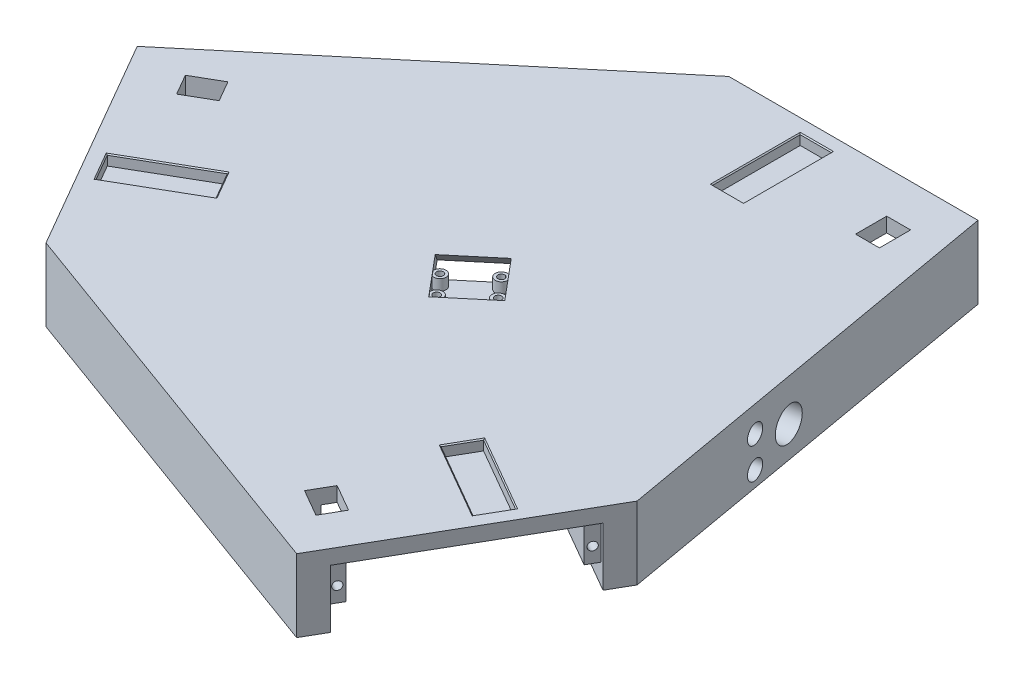
from build123d import *

# Parameters (mm, degrees)
BOSS_EXTRUDE1_DEPTH                     = 35
SKETCH2_W                               = 96
SKETCH2_H                               = 28
CUT_EXTRUDE1_DEPTH                      = 2.5
SKETCH3_W                               = 42
SKETCH3_H                               = 18
CUT_EXTRUDE2_DEPTH                      = 56
SKETCH4_R                               = 2
CUT_EXTRUDE3_DEPTH                      = 6
MOTORDRIVERCUTOUTTHROUGHSHELL_START     = -13
MOTORDRIVERCUTOUTTHROUGHSHELL_DEPTH     = 19
SKETCH20_W                              = 11.5
SKETCH20_H                              = 15
CUT_EXTRUDE8_DEPTH                      = 239.86886221
SKETCH27_W                              = 5.72
SKETCH27_H                              = 7.5
SKETCH27_W_2                            = 11.72
SKETCH27_H_2                            = 6.5
SKETCH27_W_3                            = 5.78
SKETCH27_H_3                            = 4
CUT_EXTRUDE13_DEPTH                     = 31
CUT_EXTRUDE13_DIRECTION_2_REACH         = 323.867
SKETCH29_W                              = 42.3
SKETCH29_H                              = 5.25
CUT_EXTRUDE14_DEPTH                     = 15
CHAMFER1_SIZE                           = 0.5
MOTOR_DRIVER_PATTERNED_COUNT            = 3
CHAMFER1_OF_MOTOR_DRIVER_PATTERNED_SIZE = 0.5
SHELLKINDA_DEPTH                        = 27.5
CUT_EXTRUDE18_REACH                     = 350.786
SKETCH36_R                              = 8
SKETCH36_R_2                            = 4.5
SKETCH37_R                              = 11
SKETCH37_R_2                            = 8
BOSS_EXTRUDE5_DEPTH                     = 11
SKETCH11_R                              = 3.15
SKETCH11_R_2                            = 1.65
RASPBERRYPI5_STANDOFF_DEPTH             = 5
RASPPI_START                            = -6.5
SKETCH34_R                              = 1.65
RASPPI_STANDOFF_DEPTH_DEPTH             = 6.5
RASPPICUTOUT_REACH                      = 335.716
SKETCH17_W                              = 60
SKETCH17_H                              = 20
CAMERA_CUTOUT_DEPTH                     = 6
CAMERACABLECUTOUT_REACH                 = 242.179
SKETCH32_W                              = 26
SKETCH32_H                              = 8.485281374
CAMERA_STANDOFFS_REACH                  = 240.759
SKETCH13_R                              = 2.95
SKETCH13_R_2                            = 1.65
CAMERASTANDOFFS_REACH                   = 240.759
SKETCH35_R                              = 1.65
SKETCH38_R                              = 2.05
CABLE_ROUTING_HOLES_DEPTH               = 3


with BuildPart() as part:
    # Sketch1 → Boss-Extrude1 (new body)
    with BuildSketch(Plane(origin=(0, 0, 0), x_dir=(1, 0, 0), z_dir=(0, 1, 0))):
        Polygon((-20, 144.337567297), (100, 144.337567297), (135, -54.848275573), (75, -158.771324027), (-115, -89.489291724), (-175, 14.43375673), align=None)
    extrude(amount=BOSS_EXTRUDE1_DEPTH)

    # Sketch2 → Cut-Extrude1 (cut)
    with BuildSketch(Plane(origin=(0, 0, -144.337567297), x_dir=(-1, 0, 0), z_dir=(0, 0, -1))):
        with Locations((-40, 14)):
            Rectangle(SKETCH2_W, SKETCH2_H)
    cut_extrude1 = extrude(amount=-CUT_EXTRUDE1_DEPTH, mode=Mode.SUBTRACT)

    # Sketch3 → Cut-Extrude2 (cut)
    with BuildSketch(Plane(origin=(0, 0, -141.837567297), x_dir=(-1, 0, 0), z_dir=(0, 0, -1))):
        with Locations((-61, 19)):
            Rectangle(SKETCH3_W, SKETCH3_H)
        with Locations((-19, 19)):
            Rectangle(SKETCH3_W, SKETCH3_H)
        Polygon((-88, 10), (-88, 0), (8, 0), (8, 10), (2, 10), (-40, 10), (-82, 10), align=None)
    cut_extrude2 = extrude(amount=-CUT_EXTRUDE2_DEPTH, mode=Mode.SUBTRACT)

    # Sketch4 → Cut-Extrude3 (cut)
    with BuildSketch(Plane(origin=(0, 0, -141.837567297), x_dir=(-1, 0, 0), z_dir=(0, 0, -1))):
        with Locations((-85, 17.25)):
            Circle(SKETCH4_R)
        with Locations((5, 17.25)):
            Circle(SKETCH4_R)
    cut_extrude3 = extrude(amount=-CUT_EXTRUDE3_DEPTH, mode=Mode.SUBTRACT)

    # Sketch5 → MotorDriverCutoutThroughShell (cut)
    with BuildSketch(Plane(origin=(0, 0, -85.837567297), x_dir=(-1, 0, 0), z_dir=(0, 0, -1)).offset(MOTORDRIVERCUTOUTTHROUGHSHELL_START)):
        Polygon((-72.5, 14.75), (-72.5, 30), (-7.5, 30), (-7.5, 14.75), (-7.5, 0), (-72.5, 0), align=None)
    motordrivercutoutthroughshell = extrude(amount=MOTORDRIVERCUTOUTTHROUGHSHELL_DEPTH, mode=Mode.SUBTRACT)

    # Sketch20 → Cut-Extrude8 (cut, through all)
    with BuildSketch(Plane(origin=(0, 35, 0), x_dir=(1, 0, 0), z_dir=(0, 1, 0))):
        with Locations((82.03, 116.587567297)):
            Rectangle(SKETCH20_W, SKETCH20_H)
    cut_extrude8 = extrude(amount=-CUT_EXTRUDE8_DEPTH, mode=Mode.SUBTRACT)

    # Sketch27 → Cut-Extrude13 (cut)
    with BuildSketch(Plane(origin=(0, 0, -109.087567297), x_dir=(-1, 0, 0), z_dir=(0, 0, -1))):
        Polygon((-76.28, 6.5), (-76.28, 14), (-82, 14), (-82, 10), (-87.78, 10), (-87.78, 14), (-88, 14), (-88, 6.5), align=None)
        with Locations((-79.14, 17.75)):
            Rectangle(SKETCH27_W, SKETCH27_H)
        with Locations((-82.14, 3.25)):
            Rectangle(SKETCH27_W_2, SKETCH27_H_2)
        with Locations((-84.89, 17.75)):
            Rectangle(SKETCH27_W_3, SKETCH27_H)
        with Locations((-84.89, 12)):
            Rectangle(SKETCH27_W_3, SKETCH27_H_3)
    cut_extrude13 = extrude(amount=-CUT_EXTRUDE13_DEPTH, mode=Mode.SUBTRACT)

    # Cut-Extrude13 direction 2: up to this face of the body (flat: up to its plane)
    cut_extrude13_direction_2_end = Plane(part.part.faces().sort_by_distance((83.642411401, 24.452747372, -124.087567297))[0])
    # Sketch27 → Cut-Extrude13 direction 2 (cut, up to the picked face)
    with BuildSketch(Plane(origin=(0, 0, -109.087567297), x_dir=(-1, 0, 0), z_dir=(0, 0, -1)), mode=Mode.PRIVATE) as cut_extrude13_direction_2_sk1:
        Polygon((-76.28, 6.5), (-76.28, 14), (-82, 14), (-82, 10), (-87.78, 10), (-87.78, 14), (-88, 14), (-88, 6.5), align=None)
    cut_extrude13_direction_2_tool1 = split(extrude(cut_extrude13_direction_2_sk1.sketch, amount=CUT_EXTRUDE13_DIRECTION_2_REACH, mode=Mode.PRIVATE), bisect_by=cut_extrude13_direction_2_end, keep=Keep.BOTH, mode=Mode.PRIVATE)
    # Sketch27 → Cut-Extrude13 direction 2 (cut, up to the picked face)
    with BuildSketch(Plane(origin=(0, 0, -109.087567297), x_dir=(-1, 0, 0), z_dir=(0, 0, -1)), mode=Mode.PRIVATE) as cut_extrude13_direction_2_sk2:
        with Locations((-79.14, 17.75)):
            Rectangle(SKETCH27_W, SKETCH27_H)
    cut_extrude13_direction_2_tool2 = split(extrude(cut_extrude13_direction_2_sk2.sketch, amount=CUT_EXTRUDE13_DIRECTION_2_REACH, mode=Mode.PRIVATE), bisect_by=cut_extrude13_direction_2_end, keep=Keep.BOTH, mode=Mode.PRIVATE)
    # Sketch27 → Cut-Extrude13 direction 2 (cut, up to the picked face)
    with BuildSketch(Plane(origin=(0, 0, -109.087567297), x_dir=(-1, 0, 0), z_dir=(0, 0, -1)), mode=Mode.PRIVATE) as cut_extrude13_direction_2_sk3:
        with Locations((-82.14, 3.25)):
            Rectangle(SKETCH27_W_2, SKETCH27_H_2)
    cut_extrude13_direction_2_tool3 = split(extrude(cut_extrude13_direction_2_sk3.sketch, amount=CUT_EXTRUDE13_DIRECTION_2_REACH, mode=Mode.PRIVATE), bisect_by=cut_extrude13_direction_2_end, keep=Keep.BOTH, mode=Mode.PRIVATE)
    # Sketch27 → Cut-Extrude13 direction 2 (cut, up to the picked face)
    with BuildSketch(Plane(origin=(0, 0, -109.087567297), x_dir=(-1, 0, 0), z_dir=(0, 0, -1)), mode=Mode.PRIVATE) as cut_extrude13_direction_2_sk4:
        with Locations((-84.89, 17.75)):
            Rectangle(SKETCH27_W_3, SKETCH27_H)
    cut_extrude13_direction_2_tool4 = split(extrude(cut_extrude13_direction_2_sk4.sketch, amount=CUT_EXTRUDE13_DIRECTION_2_REACH, mode=Mode.PRIVATE), bisect_by=cut_extrude13_direction_2_end, keep=Keep.BOTH, mode=Mode.PRIVATE)
    # Sketch27 → Cut-Extrude13 direction 2 (cut, up to the picked face)
    with BuildSketch(Plane(origin=(0, 0, -109.087567297), x_dir=(-1, 0, 0), z_dir=(0, 0, -1)), mode=Mode.PRIVATE) as cut_extrude13_direction_2_sk5:
        with Locations((-84.89, 12)):
            Rectangle(SKETCH27_W_3, SKETCH27_H_3)
    cut_extrude13_direction_2_tool5 = split(extrude(cut_extrude13_direction_2_sk5.sketch, amount=CUT_EXTRUDE13_DIRECTION_2_REACH, mode=Mode.PRIVATE), bisect_by=cut_extrude13_direction_2_end, keep=Keep.BOTH, mode=Mode.PRIVATE)
    cut_extrude13_direction_2_1 = cut_extrude13_direction_2_tool1.solids().sort_by(Axis((81.158524, 9.625425, -109.087567), (0, 0, -1)))[0]
    add(cut_extrude13_direction_2_1, mode=Mode.SUBTRACT)
    cut_extrude13_direction_2_2 = cut_extrude13_direction_2_tool2.solids().sort_by(Axis((79.14, 17.75, -109.087567), (0, 0, -1)))[0]
    add(cut_extrude13_direction_2_2, mode=Mode.SUBTRACT)
    cut_extrude13_direction_2_3 = cut_extrude13_direction_2_tool3.solids().sort_by(Axis((82.14, 3.25, -109.087567), (0, 0, -1)))[0]
    add(cut_extrude13_direction_2_3, mode=Mode.SUBTRACT)
    cut_extrude13_direction_2_4 = cut_extrude13_direction_2_tool4.solids().sort_by(Axis((84.89, 17.75, -109.087567), (0, 0, -1)))[0]
    add(cut_extrude13_direction_2_4, mode=Mode.SUBTRACT)
    cut_extrude13_direction_2_5 = cut_extrude13_direction_2_tool5.solids().sort_by(Axis((84.89, 12, -109.087567), (0, 0, -1)))[0]
    add(cut_extrude13_direction_2_5, mode=Mode.SUBTRACT)
    cut_extrude13_direction_2 = cut_extrude13_direction_2_1 + cut_extrude13_direction_2_2 + cut_extrude13_direction_2_3 + cut_extrude13_direction_2_4 + cut_extrude13_direction_2_5  # Cut-Extrude13 direction 2 as one shape, for the pattern or mirror that repeats it

    # Sketch29 → Cut-Extrude14 (cut)
    with BuildSketch(Plane(origin=(36, 0, 0), x_dir=(0, 0, -1), z_dir=(1, 0, 0))):
        with Locations((116.587567297, 32.625)):
            Rectangle(SKETCH29_W, SKETCH29_H)
    cut_extrude14 = extrude(amount=-CUT_EXTRUDE14_DEPTH, mode=Mode.SUBTRACT)

    # Chamfer1
    chamfer1_edges = [part.edges().sort_by_distance(p)[0] for p in [
        (36, 35, -116.587567297),
        (28.5, 35, -137.737567297),
        (28.5, 35, -95.437567297),
        (21, 35, -116.587567297),
    ]]
    chamfer(chamfer1_edges, length=CHAMFER1_SIZE)

    # Motor/Driver Patterned: Cut-Extrude1, Cut-Extrude2, Cut-Extrude3, MotorDriverCutoutThroughShell, Cut-Extrude8, Cut-Extrude13, Cut-Extrude13 direction 2, Cut-Extrude14 ×3 about axis
    motor_driver_patterned_axis = Axis((0, 0, 0), (0, 1, 0))
    add([cut_extrude1.rotate(motor_driver_patterned_axis, i * 360 / MOTOR_DRIVER_PATTERNED_COUNT) for i in range(1, MOTOR_DRIVER_PATTERNED_COUNT)], mode=Mode.SUBTRACT)
    add([cut_extrude2.rotate(motor_driver_patterned_axis, i * 360 / MOTOR_DRIVER_PATTERNED_COUNT) for i in range(1, MOTOR_DRIVER_PATTERNED_COUNT)], mode=Mode.SUBTRACT)
    add([cut_extrude3.rotate(motor_driver_patterned_axis, i * 360 / MOTOR_DRIVER_PATTERNED_COUNT) for i in range(1, MOTOR_DRIVER_PATTERNED_COUNT)], mode=Mode.SUBTRACT)
    add([motordrivercutoutthroughshell.rotate(motor_driver_patterned_axis, i * 360 / MOTOR_DRIVER_PATTERNED_COUNT) for i in range(1, MOTOR_DRIVER_PATTERNED_COUNT)], mode=Mode.SUBTRACT)
    add([cut_extrude8.rotate(motor_driver_patterned_axis, i * 360 / MOTOR_DRIVER_PATTERNED_COUNT) for i in range(1, MOTOR_DRIVER_PATTERNED_COUNT)], mode=Mode.SUBTRACT)
    add([cut_extrude13.rotate(motor_driver_patterned_axis, i * 360 / MOTOR_DRIVER_PATTERNED_COUNT) for i in range(1, MOTOR_DRIVER_PATTERNED_COUNT)], mode=Mode.SUBTRACT)
    add([cut_extrude13_direction_2.rotate(motor_driver_patterned_axis, i * 360 / MOTOR_DRIVER_PATTERNED_COUNT) for i in range(1, MOTOR_DRIVER_PATTERNED_COUNT)], mode=Mode.SUBTRACT)
    add([cut_extrude14.rotate(motor_driver_patterned_axis, i * 360 / MOTOR_DRIVER_PATTERNED_COUNT) for i in range(1, MOTOR_DRIVER_PATTERNED_COUNT)], mode=Mode.SUBTRACT)

    # Chamfer1 of Motor/Driver Patterned
    chamfer1_of_motor_driver_patterned_edges = [part.edges().sort_by_distance(p)[0] for p in [
        (-118.967795045, 35, 27.116869112),
        (-133.534232335, 35, 44.187059641),
        (-96.901357755, 35, 23.037059641),
        (-111.467795045, 35, 40.107250169),
        (82.967795045, 35, 89.470698185),
        (105.034232335, 35, 93.550507657),
        (68.401357755, 35, 72.400507657),
        (90.467795045, 35, 76.480317128),
    ]]
    chamfer(chamfer1_of_motor_driver_patterned_edges, length=CHAMFER1_OF_MOTOR_DRIVER_PATTERNED_SIZE)

    # Sketch22 → ShellKinda (cut)
    with BuildSketch(Plane.XZ):
        Polygon((-60.09232335, 52.592177407), (-71.59232335, 32.67359312), (-66.829183629, 29.92359312), (-99.329183629, -26.368058126), (-110.587513879, -19.868058126), (-112.477513879, -23.141634152), (-105.765816999, -27.016634152), (-111.625816999, -37.166451884), (-111.84232335, -37.041451884), (-119.833476078, -50.88253442), (-17.27274258, -136.837567297), (-15.5, -136.837567297), (-15.5, -78.337567297), (7.5, -78.337567297), (7.5, -72.837567297), (72.5, -72.837567297), (72.5, -85.837567297), (76.28, -85.837567297), (76.28, -78.087567297), (88, -78.087567297), (88, -78.337567297), (103.982305456, -78.337567297), (127.141180762, 53.460149781), (126.254809472, 54.99538989), (75.59232335, 25.74538989), (64.09232335, 45.663974177), (59.329183629, 42.913974177), (26.829183629, 99.205625423), (38.087513879, 105.705625423), (36.197513879, 108.979201449), (29.485816999, 105.104201449), (23.625816999, 115.254019182), (23.84232335, 115.379019182), (15.851170622, 129.220101718), (-109.868438181, 83.377417516), (-110.754809472, 81.842177407), align=None)
    extrude(amount=-SHELLKINDA_DEPTH, mode=Mode.SUBTRACT)

    # Sketch36 → Cut-Extrude18 (cut, up to next)
    with BuildSketch(Plane(origin=(121.607579462, 0, -21.368312225), x_dir=(0.17306386175195196, 0, 0.9849106049563591), z_dir=(-0.9849106049563591, 0, 0.17306386175195196)), mode=Mode.PRIVATE) as cut_extrude18_sk1:
        with Locations(Location((-12.615730388, 15, 0), (0, 0, 180))):
            Circle(SKETCH36_R)
    cut_extrude18_tool1 = extrude(cut_extrude18_sk1.sketch, amount=CUT_EXTRUDE18_REACH, mode=Mode.PRIVATE) & part.part
    # Sketch36 → Cut-Extrude18 (cut, up to next)
    with BuildSketch(Plane(origin=(121.607579462, 0, -21.368312225), x_dir=(0.17306386175195196, 0, 0.9849106049563591), z_dir=(-0.9849106049563591, 0, 0.17306386175195196)), mode=Mode.PRIVATE) as cut_extrude18_sk2:
        with Locations(Location((7.384269612, 22.5, 0), (0, 0, 180))):
            Circle(SKETCH36_R_2)
    cut_extrude18_tool2 = extrude(cut_extrude18_sk2.sketch, amount=CUT_EXTRUDE18_REACH, mode=Mode.PRIVATE) & part.part
    # Sketch36 → Cut-Extrude18 (cut, up to next)
    with BuildSketch(Plane(origin=(121.607579462, 0, -21.368312225), x_dir=(0.17306386175195196, 0, 0.9849106049563591), z_dir=(-0.9849106049563591, 0, 0.17306386175195196)), mode=Mode.PRIVATE) as cut_extrude18_sk3:
        with Locations(Location((7.384269612, 7.5, 0), (0, 0, 180))):
            Circle(SKETCH36_R_2)
    cut_extrude18_tool3 = extrude(cut_extrude18_sk3.sketch, amount=CUT_EXTRUDE18_REACH, mode=Mode.PRIVATE) & part.part
    add(cut_extrude18_tool1.solids().sort_by_distance((119.424252, 15, -33.793679))[0], mode=Mode.SUBTRACT)
    add(cut_extrude18_tool2.solids().sort_by_distance((122.88553, 22.5, -14.095467))[0], mode=Mode.SUBTRACT)
    add(cut_extrude18_tool3.solids().sort_by_distance((122.88553, 7.5, -14.095467))[0], mode=Mode.SUBTRACT)

    # Sketch37 → Boss-Extrude5 (add)
    with BuildSketch(Plane(origin=(66.088285485, 0, -337.329951263), x_dir=(0.17306386175195196, 0, 0.9849106049563591), z_dir=(-0.9849106049563591, 0, 0.17306386175195196))):
        with Locations(Location((308.186622077, 15, 0), (0, 0, 180))):
            Circle(SKETCH37_R)
        with Locations(Location((308.186622077, 15, 0), (0, 0, 180))):
            Circle(SKETCH37_R_2, mode=Mode.SUBTRACT)
    extrude(amount=BOSS_EXTRUDE5_DEPTH)

    # Sketch11 → RaspberryPi5 Standoff (add)
    # profile 1 of 4: a face of its own
    with BuildSketch(Plane(origin=(0, 30, 0), x_dir=(1, 0, 0), z_dir=(0, 1, 0))):
        with Locations(Location((-0.794892653, 39.090667941, 0), (0, 0, 270))):
            Circle(SKETCH11_R)
        with Locations(Location((-0.794892653, 39.090667941, 0), (0, 0, 270))):
            Circle(SKETCH11_R_2, mode=Mode.SUBTRACT)
    # profile 2 of 4: a face of its own
    with BuildSketch(Plane(origin=(0, 30, 0), x_dir=(1, 0, 0), z_dir=(0, 1, 0))):
        with Locations(Location((-38.05020684, 83.543357002, 0), (0, 0, 270))):
            Circle(SKETCH11_R)
        with Locations(Location((-38.05020684, 83.543357002, 0), (0, 0, 270))):
            Circle(SKETCH11_R_2, mode=Mode.SUBTRACT)
    # profile 3 of 4: a face of its own
    with BuildSketch(Plane(origin=(0, 30, 0), x_dir=(1, 0, 0), z_dir=(0, 1, 0))):
        with Locations(Location((-75.60506484, 52.069039844, 0), (0, 0, 270))):
            Circle(SKETCH11_R)
        with Locations(Location((-75.60506484, 52.069039844, 0), (0, 0, 270))):
            Circle(SKETCH11_R_2, mode=Mode.SUBTRACT)
    # profile 4 of 4: a face of its own
    with BuildSketch(Plane(origin=(0, 30, 0), x_dir=(1, 0, 0), z_dir=(0, 1, 0))):
        with Locations(Location((-38.349750653, 7.616350782, 0), (0, 0, 270))):
            Circle(SKETCH11_R)
        with Locations(Location((-38.349750653, 7.616350782, 0), (0, 0, 270))):
            Circle(SKETCH11_R_2, mode=Mode.SUBTRACT)
    extrude(amount=-RASPBERRYPI5_STANDOFF_DEPTH)

    # Sketch34 → RaspPi Standoff Depth (cut)
    with BuildSketch(Plane.XZ.offset(-27.5).offset(RASPPI_START)):
        with Locations(Location((-38.05020684, -83.543357002, 0), (0, 0, 90))):
            Circle(SKETCH34_R)
        with Locations(Location((-75.60506484, -52.069039844, 0), (0, 0, 90))):
            Circle(SKETCH34_R)
        with Locations(Location((-0.794892653, -39.090667941, 0), (0, 0, 90))):
            Circle(SKETCH34_R)
        with Locations(Location((-38.349750653, -7.616350782, 0), (0, 0, 90))):
            Circle(SKETCH34_R)
    extrude(amount=RASPPI_STANDOFF_DEPTH_DEPTH, mode=Mode.SUBTRACT)

    # Sketch17 → RaspPiCutout (cut, up to next)
    with BuildSketch(Plane(origin=(-79.309290954, 0, -94.631096995), x_dir=(-0.7664256734729306, 0, 0.6423330032324082), z_dir=(-0.6423330032324082, 0, -0.7664256734729307)), mode=Mode.PRIVATE) as rasppicutout_sk1:
        with Locations((0, 15)):
            Rectangle(SKETCH17_W, SKETCH17_H)
    rasppicutout_tool1 = extrude(rasppicutout_sk1.sketch, amount=-RASPPICUTOUT_REACH, mode=Mode.PRIVATE) & part.part
    add(rasppicutout_tool1.solids().sort_by_distance((-79.309291, 15, -94.631097))[0], mode=Mode.SUBTRACT)

    # Sketch31 → Camera Cutout (cut)
    with BuildSketch(Plane(origin=(0, 35, 0), x_dir=(1, 0, 0), z_dir=(0, 1, 0))):
        Polygon((-16.418980438, -0.647751024), (3.508087073, 16.05290706), (19.566412153, -3.107734776), (-0.360655357, -19.80839286), align=None)
    extrude(amount=-CAMERA_CUTOUT_DEPTH, mode=Mode.SUBTRACT)

    # CameraCableCutout: up to this plane
    cameracablecutout_end = Plane(origin=(0, 27.5, 0), z_dir=(0, 1, 0))
    # Sketch32 → CameraCableCutout (cut, up to the surface)
    with BuildSketch(Plane(origin=(8.013104215, 12.475, 9.561160277), x_dir=(-0.7664256734729306, 0, 0.6423330032324083), z_dir=(0.4541980223655573, 0.7071067811865464, 0.5419447909881768)), mode=Mode.PRIVATE) as cameracablecutout_sk1:
        with Locations((0, -27.612519805)):
            Rectangle(SKETCH32_W, SKETCH32_H)
    cameracablecutout_tool1 = split(extrude(cameracablecutout_sk1.sketch, amount=-CAMERACABLECUTOUT_REACH, mode=Mode.PRIVATE), bisect_by=cameracablecutout_end, keep=Keep.BOTH, mode=Mode.PRIVATE)
    add(cameracablecutout_tool1.solids().sort_by_distance((-4.528448, 32, -5.403301))[0], mode=Mode.SUBTRACT)

    # Sketch13 → Camera StandOffs (add, up to next)
    with BuildSketch(Plane(origin=(0, 34.24, 0), x_dir=(1, 0, 0), z_dir=(0, 1, 0)), mode=Mode.PRIVATE) as camera_standoffs_sk1:
        with Locations((-8.047469571, -6.744496534)):
            Circle(SKETCH13_R)
        with Locations(Location((-8.047469571, -6.744496534, 0), (0, 0, 270))):
            Circle(SKETCH13_R_2, mode=Mode.SUBTRACT)
    camera_standoffs_tool1 = extrude(camera_standoffs_sk1.sketch, amount=-CAMERA_STANDOFFS_REACH, mode=Mode.PRIVATE) - part.part
    # Sketch13 → Camera StandOffs (add, up to next)
    with BuildSketch(Plane(origin=(0, 34.24, 0), x_dir=(1, 0, 0), z_dir=(0, 1, 0)), mode=Mode.PRIVATE) as camera_standoffs_sk2:
        with Locations((8.047469571, 6.744496534)):
            Circle(SKETCH13_R)
        with Locations(Location((8.047469571, 6.744496534, 0), (0, 0, 270))):
            Circle(SKETCH13_R_2, mode=Mode.SUBTRACT)
    camera_standoffs_tool2 = extrude(camera_standoffs_sk2.sketch, amount=-CAMERA_STANDOFFS_REACH, mode=Mode.PRIVATE) - part.part
    # Sketch13 → Camera StandOffs (add, up to next)
    with BuildSketch(Plane(origin=(0, 34.24, 0), x_dir=(1, 0, 0), z_dir=(0, 1, 0)), mode=Mode.PRIVATE) as camera_standoffs_sk3:
        with Locations((16.076632112, -2.835824384)):
            Circle(SKETCH13_R)
        with Locations(Location((16.076632112, -2.835824384, 0), (0, 0, 270))):
            Circle(SKETCH13_R_2, mode=Mode.SUBTRACT)
    camera_standoffs_tool3 = extrude(camera_standoffs_sk3.sketch, amount=-CAMERA_STANDOFFS_REACH, mode=Mode.PRIVATE) - part.part
    # Sketch13 → Camera StandOffs (add, up to next)
    with BuildSketch(Plane(origin=(0, 34.24, 0), x_dir=(1, 0, 0), z_dir=(0, 1, 0)), mode=Mode.PRIVATE) as camera_standoffs_sk4:
        with Locations((-0.018307031, -16.324817452)):
            Circle(SKETCH13_R)
        with Locations(Location((-0.018307031, -16.324817452, 0), (0, 0, 270))):
            Circle(SKETCH13_R_2, mode=Mode.SUBTRACT)
    camera_standoffs_tool4 = extrude(camera_standoffs_sk4.sketch, amount=-CAMERA_STANDOFFS_REACH, mode=Mode.PRIVATE) - part.part
    add(camera_standoffs_tool1.solids().sort_by_distance((-10.914031, 34.24, 6.744497))[0])
    add(camera_standoffs_tool2.solids().sort_by_distance((5.180908, 34.24, -6.744497))[0])
    add(camera_standoffs_tool3.solids().sort_by_distance((13.210071, 34.24, 2.835824))[0])
    add(camera_standoffs_tool4.solids().sort_by_distance((-2.884868, 34.24, 16.324817))[0])

    # Sketch35 → CameraStandoffs (cut, up to next)
    with BuildSketch(Plane(origin=(0, 34.24, 0), x_dir=(1, 0, 0), z_dir=(0, 1, 0)), mode=Mode.PRIVATE) as camerastandoffs_sk1:
        with Locations(Location((-0.018307031, -16.324817452, 0), (0, 0, 270))):
            Circle(SKETCH35_R)
    camerastandoffs_tool1 = extrude(camerastandoffs_sk1.sketch, amount=-CAMERASTANDOFFS_REACH, mode=Mode.PRIVATE) & part.part
    # Sketch35 → CameraStandoffs (cut, up to next)
    with BuildSketch(Plane(origin=(0, 34.24, 0), x_dir=(1, 0, 0), z_dir=(0, 1, 0)), mode=Mode.PRIVATE) as camerastandoffs_sk2:
        with Locations(Location((-8.047469571, -6.744496534, 0), (0, 0, 270))):
            Circle(SKETCH35_R)
    camerastandoffs_tool2 = extrude(camerastandoffs_sk2.sketch, amount=-CAMERASTANDOFFS_REACH, mode=Mode.PRIVATE) & part.part
    # Sketch35 → CameraStandoffs (cut, up to next)
    with BuildSketch(Plane(origin=(0, 34.24, 0), x_dir=(1, 0, 0), z_dir=(0, 1, 0)), mode=Mode.PRIVATE) as camerastandoffs_sk3:
        with Locations(Location((16.076632112, -2.835824384, 0), (0, 0, 270))):
            Circle(SKETCH35_R)
    camerastandoffs_tool3 = extrude(camerastandoffs_sk3.sketch, amount=-CAMERASTANDOFFS_REACH, mode=Mode.PRIVATE) & part.part
    # Sketch35 → CameraStandoffs (cut, up to next)
    with BuildSketch(Plane(origin=(0, 34.24, 0), x_dir=(1, 0, 0), z_dir=(0, 1, 0)), mode=Mode.PRIVATE) as camerastandoffs_sk4:
        with Locations(Location((8.047469571, 6.744496534, 0), (0, 0, 270))):
            Circle(SKETCH35_R)
    camerastandoffs_tool4 = extrude(camerastandoffs_sk4.sketch, amount=-CAMERASTANDOFFS_REACH, mode=Mode.PRIVATE) & part.part
    add(camerastandoffs_tool1.solids().sort_by_distance((-0.018307, 34.24, 16.324817))[0], mode=Mode.SUBTRACT)
    add(camerastandoffs_tool2.solids().sort_by_distance((-8.04747, 34.24, 6.744497))[0], mode=Mode.SUBTRACT)
    add(camerastandoffs_tool3.solids().sort_by_distance((16.076632, 34.24, 2.835824))[0], mode=Mode.SUBTRACT)
    add(camerastandoffs_tool4.solids().sort_by_distance((8.04747, 34.24, -6.744497))[0], mode=Mode.SUBTRACT)

    # Sketch38 → Cable Routing Holes (cut)
    with BuildSketch(Plane.XZ.offset(-27.5)):
        with Locations(Location((7.5, -62.837567297, 0), (0, 0, 270))):
            Circle(SKETCH38_R)
        with Locations(Location((17.5, -62.837567297, 0), (0, 0, 270))):
            Circle(SKETCH38_R)
        with Locations(Location((27.5, -62.837567297, 0), (0, 0, 270))):
            Circle(SKETCH38_R)
        with Locations(Location((37.5, -62.837567297, 0), (0, 0, 270))):
            Circle(SKETCH38_R)
        with Locations(Location((47.5, -62.837567297, 0), (0, 0, 270))):
            Circle(SKETCH38_R)
        with Locations(Location((57.5, -62.837567297, 0), (0, 0, 270))):
            Circle(SKETCH38_R)
        with Locations(Location((67.5, -62.837567297, 0), (0, 0, 270))):
            Circle(SKETCH38_R)
        with Locations(Location((77.5, -62.837567297, 0), (0, 0, 270))):
            Circle(SKETCH38_R)
        with Locations(Location((17.5, -52.837567297, 0), (0, 0, 270))):
            Circle(SKETCH38_R)
        with Locations(Location((27.5, -52.837567297, 0), (0, 0, 270))):
            Circle(SKETCH38_R)
        with Locations(Location((37.5, -52.837567297, 0), (0, 0, 270))):
            Circle(SKETCH38_R)
        with Locations(Location((47.5, -52.837567297, 0), (0, 0, 270))):
            Circle(SKETCH38_R)
        with Locations(Location((57.5, -52.837567297, 0), (0, 0, 270))):
            Circle(SKETCH38_R)
        with Locations(Location((67.5, -52.837567297, 0), (0, 0, 270))):
            Circle(SKETCH38_R)
        with Locations(Location((77.5, -52.837567297, 0), (0, 0, 270))):
            Circle(SKETCH38_R)
        with Locations(Location((17.5, -42.837567297, 0), (0, 0, 270))):
            Circle(SKETCH38_R)
        with Locations(Location((27.5, -42.837567297, 0), (0, 0, 270))):
            Circle(SKETCH38_R)
        with Locations(Location((37.5, -42.837567297, 0), (0, 0, 270))):
            Circle(SKETCH38_R)
        with Locations(Location((47.5, -42.837567297, 0), (0, 0, 270))):
            Circle(SKETCH38_R)
        with Locations(Location((57.5, -42.837567297, 0), (0, 0, 270))):
            Circle(SKETCH38_R)
        with Locations(Location((67.5, -42.837567297, 0), (0, 0, 270))):
            Circle(SKETCH38_R)
        with Locations(Location((77.5, -42.837567297, 0), (0, 0, 270))):
            Circle(SKETCH38_R)
        with Locations(Location((17.5, -32.837567297, 0), (0, 0, 270))):
            Circle(SKETCH38_R)
        with Locations(Location((27.5, -32.837567297, 0), (0, 0, 270))):
            Circle(SKETCH38_R)
        with Locations(Location((37.5, -32.837567297, 0), (0, 0, 270))):
            Circle(SKETCH38_R)
        with Locations(Location((47.5, -32.837567297, 0), (0, 0, 270))):
            Circle(SKETCH38_R)
        with Locations(Location((57.5, -32.837567297, 0), (0, 0, 270))):
            Circle(SKETCH38_R)
        with Locations(Location((67.5, -32.837567297, 0), (0, 0, 270))):
            Circle(SKETCH38_R)
        with Locations(Location((77.5, -32.837567297, 0), (0, 0, 270))):
            Circle(SKETCH38_R)
        with Locations(Location((17.5, -22.837567297, 0), (0, 0, 270))):
            Circle(SKETCH38_R)
        with Locations(Location((27.5, -22.837567297, 0), (0, 0, 270))):
            Circle(SKETCH38_R)
        with Locations(Location((37.5, -22.837567297, 0), (0, 0, 270))):
            Circle(SKETCH38_R)
        with Locations(Location((47.5, -22.837567297, 0), (0, 0, 270))):
            Circle(SKETCH38_R)
        with Locations(Location((57.5, -22.837567297, 0), (0, 0, 270))):
            Circle(SKETCH38_R)
        with Locations(Location((67.5, -22.837567297, 0), (0, 0, 270))):
            Circle(SKETCH38_R)
        with Locations(Location((77.5, -22.837567297, 0), (0, 0, 270))):
            Circle(SKETCH38_R)
        with Locations(Location((17.5, -12.837567297, 0), (0, 0, 270))):
            Circle(SKETCH38_R)
        with Locations(Location((27.5, -12.837567297, 0), (0, 0, 270))):
            Circle(SKETCH38_R)
        with Locations(Location((37.5, -12.837567297, 0), (0, 0, 270))):
            Circle(SKETCH38_R)
        with Locations(Location((47.5, -12.837567297, 0), (0, 0, 270))):
            Circle(SKETCH38_R)
        with Locations(Location((57.5, -12.837567297, 0), (0, 0, 270))):
            Circle(SKETCH38_R)
        with Locations(Location((67.5, -12.837567297, 0), (0, 0, 270))):
            Circle(SKETCH38_R)
        with Locations(Location((77.5, -12.837567297, 0), (0, 0, 270))):
            Circle(SKETCH38_R)
        with Locations(Location((27.5, -2.837567297, 0), (0, 0, 270))):
            Circle(SKETCH38_R)
        with Locations(Location((37.5, -2.837567297, 0), (0, 0, 270))):
            Circle(SKETCH38_R)
        with Locations(Location((47.5, -2.837567297, 0), (0, 0, 270))):
            Circle(SKETCH38_R)
        with Locations(Location((57.5, -2.837567297, 0), (0, 0, 270))):
            Circle(SKETCH38_R)
        with Locations(Location((67.5, -2.837567297, 0), (0, 0, 270))):
            Circle(SKETCH38_R)
        with Locations(Location((77.5, -2.837567297, 0), (0, 0, 270))):
            Circle(SKETCH38_R)
        with Locations(Location((37.5, 7.162432703, 0), (0, 0, 270))):
            Circle(SKETCH38_R)
        with Locations(Location((47.5, 7.162432703, 0), (0, 0, 270))):
            Circle(SKETCH38_R)
        with Locations(Location((57.5, 7.162432703, 0), (0, 0, 270))):
            Circle(SKETCH38_R)
        with Locations(Location((67.5, 7.162432703, 0), (0, 0, 270))):
            Circle(SKETCH38_R)
        with Locations(Location((77.5, 7.162432703, 0), (0, 0, 270))):
            Circle(SKETCH38_R)
        with Locations(Location((7.5, -52.837567297, 0), (0, 0, 270))):
            Circle(SKETCH38_R)
        with Locations(Location((7.5, -42.837567297, 0), (0, 0, 270))):
            Circle(SKETCH38_R)
        with Locations(Location((7.5, -32.837567297, 0), (0, 0, 270))):
            Circle(SKETCH38_R)
        with Locations(Location((7.5, -22.837567297, 0), (0, 0, 270))):
            Circle(SKETCH38_R)
        with Locations(Location((-93.168929592, -35.698185145, 0), (0, 0, 270))):
            Circle(SKETCH38_R)
        with Locations(Location((-88.168929592, -27.037931107, 0), (0, 0, 270))):
            Circle(SKETCH38_R)
        with Locations(Location((-83.168929592, -18.377677069, 0), (0, 0, 270))):
            Circle(SKETCH38_R)
        with Locations(Location((-78.168929592, -9.717423031, 0), (0, 0, 270))):
            Circle(SKETCH38_R)
        with Locations(Location((-73.168929592, -1.057168993, 0), (0, 0, 270))):
            Circle(SKETCH38_R)
        with Locations(Location((-68.168929592, 7.603085045, 0), (0, 0, 270))):
            Circle(SKETCH38_R)
        with Locations(Location((-63.168929592, 16.263339082, 0), (0, 0, 270))):
            Circle(SKETCH38_R)
        with Locations(Location((-58.168929592, 24.92359312, 0), (0, 0, 270))):
            Circle(SKETCH38_R)
        with Locations(Location((-49.508675554, 19.92359312, 0), (0, 0, 270))):
            Circle(SKETCH38_R)
        with Locations(Location((-54.508675554, 11.263339082, 0), (0, 0, 270))):
            Circle(SKETCH38_R)
        with Locations(Location((-45.848421516, 6.263339082, 0), (0, 0, 270))):
            Circle(SKETCH38_R)
        with Locations(Location((-40.848421516, 14.92359312, 0), (0, 0, 270))):
            Circle(SKETCH38_R)
        with Locations(Location((-32.188167478, 9.92359312, 0), (0, 0, 270))):
            Circle(SKETCH38_R)
        with Locations(Location((-37.188167478, 1.263339082, 0), (0, 0, 270))):
            Circle(SKETCH38_R)
        with Locations(Location((-28.52791344, -3.736660918, 0), (0, 0, 270))):
            Circle(SKETCH38_R)
        with Locations(Location((-23.52791344, 4.92359312, 0), (0, 0, 270))):
            Circle(SKETCH38_R)
        with Locations(Location((-16.207405365, -22.396914955, 0), (0, 0, 270))):
            Circle(SKETCH38_R)
        with Locations(Location((-21.207405365, -31.057168993, 0), (0, 0, 270))):
            Circle(SKETCH38_R)
        with Locations(Location((-29.867659402, -26.057168993, 0), (0, 0, 270))):
            Circle(SKETCH38_R)
        with Locations(Location((-24.867659402, -17.396914955, 0), (0, 0, 270))):
            Circle(SKETCH38_R)
        with Locations(Location((-34.867659402, -34.717423031, 0), (0, 0, 270))):
            Circle(SKETCH38_R)
        with Locations(Location((-26.207405365, -39.717423031, 0), (0, 0, 270))):
            Circle(SKETCH38_R)
        with Locations(Location((-12.547151327, -36.057168993, 0), (0, 0, 270))):
            Circle(SKETCH38_R)
        with Locations(Location((-17.547151327, -44.717423031, 0), (0, 0, 270))):
            Circle(SKETCH38_R)
        with Locations(Location((-22.547151327, -53.377677069, 0), (0, 0, 270))):
            Circle(SKETCH38_R)
        with Locations(Location((-27.547151327, -62.037931107, 0), (0, 0, 270))):
            Circle(SKETCH38_R)
        with Locations(Location((-32.547151327, -70.698185145, 0), (0, 0, 270))):
            Circle(SKETCH38_R)
        with Locations(Location((-41.207405365, -65.698185145, 0), (0, 0, 270))):
            Circle(SKETCH38_R)
        with Locations(Location((-36.207405365, -57.037931107, 0), (0, 0, 270))):
            Circle(SKETCH38_R)
        with Locations(Location((-31.207405365, -48.377677069, 0), (0, 0, 270))):
            Circle(SKETCH38_R)
        with Locations(Location((-39.867659402, -43.377677069, 0), (0, 0, 270))):
            Circle(SKETCH38_R)
        with Locations(Location((-44.867659402, -52.037931107, 0), (0, 0, 270))):
            Circle(SKETCH38_R)
        with Locations(Location((-49.867659402, -60.698185145, 0), (0, 0, 270))):
            Circle(SKETCH38_R)
        with Locations(Location((-58.52791344, -55.698185145, 0), (0, 0, 270))):
            Circle(SKETCH38_R)
        with Locations(Location((-53.52791344, -47.037931107, 0), (0, 0, 270))):
            Circle(SKETCH38_R)
        with Locations(Location((-48.52791344, -38.377677069, 0), (0, 0, 270))):
            Circle(SKETCH38_R)
        with Locations(Location((-43.52791344, -29.717423031, 0), (0, 0, 270))):
            Circle(SKETCH38_R)
        with Locations(Location((-38.52791344, -21.057168993, 0), (0, 0, 270))):
            Circle(SKETCH38_R)
        with Locations(Location((-33.52791344, -12.396914955, 0), (0, 0, 270))):
            Circle(SKETCH38_R)
        with Locations(Location((-47.188167478, -16.057168993, 0), (0, 0, 270))):
            Circle(SKETCH38_R)
        with Locations(Location((-55.848421516, -11.057168993, 0), (0, 0, 270))):
            Circle(SKETCH38_R)
        with Locations(Location((-50.848421516, -2.396914955, 0), (0, 0, 270))):
            Circle(SKETCH38_R)
        with Locations(Location((-59.508675554, 2.603085045, 0), (0, 0, 270))):
            Circle(SKETCH38_R)
        with Locations(Location((-64.508675554, -6.057168993, 0), (0, 0, 270))):
            Circle(SKETCH38_R)
        with Locations(Location((-69.508675554, -14.717423031, 0), (0, 0, 270))):
            Circle(SKETCH38_R)
        with Locations(Location((-60.848421516, -19.717423031, 0), (0, 0, 270))):
            Circle(SKETCH38_R)
        with Locations(Location((-52.188167478, -24.717423031, 0), (0, 0, 270))):
            Circle(SKETCH38_R)
        with Locations(Location((-57.188167478, -33.377677069, 0), (0, 0, 270))):
            Circle(SKETCH38_R)
        with Locations(Location((-62.188167478, -42.037931107, 0), (0, 0, 270))):
            Circle(SKETCH38_R)
        with Locations(Location((-67.188167478, -50.698185145, 0), (0, 0, 270))):
            Circle(SKETCH38_R)
        with Locations(Location((-75.848421516, -45.698185145, 0), (0, 0, 270))):
            Circle(SKETCH38_R)
        with Locations(Location((-70.848421516, -37.037931107, 0), (0, 0, 270))):
            Circle(SKETCH38_R)
        with Locations(Location((-65.848421516, -28.377677069, 0), (0, 0, 270))):
            Circle(SKETCH38_R)
        with Locations(Location((-74.508675554, -23.377677069, 0), (0, 0, 270))):
            Circle(SKETCH38_R)
        with Locations(Location((-79.508675554, -32.037931107, 0), (0, 0, 270))):
            Circle(SKETCH38_R)
        with Locations(Location((-84.508675554, -40.698185145, 0), (0, 0, 270))):
            Circle(SKETCH38_R)
        with Locations(Location((15.668929592, 98.535752442, 0), (0, 0, 270))):
            Circle(SKETCH38_R)
        with Locations(Location((20.668929592, 89.875498404, 0), (0, 0, 270))):
            Circle(SKETCH38_R)
        with Locations(Location((25.668929592, 81.215244366, 0), (0, 0, 270))):
            Circle(SKETCH38_R)
        with Locations(Location((30.668929592, 72.554990328, 0), (0, 0, 270))):
            Circle(SKETCH38_R)
        with Locations(Location((35.668929592, 63.894736291, 0), (0, 0, 270))):
            Circle(SKETCH38_R)
        with Locations(Location((40.668929592, 55.234482253, 0), (0, 0, 270))):
            Circle(SKETCH38_R)
        with Locations(Location((45.668929592, 46.574228215, 0), (0, 0, 270))):
            Circle(SKETCH38_R)
        with Locations(Location((50.668929592, 37.913974177, 0), (0, 0, 270))):
            Circle(SKETCH38_R)
        with Locations(Location((42.008675554, 32.913974177, 0), (0, 0, 270))):
            Circle(SKETCH38_R)
        with Locations(Location((37.008675554, 41.574228215, 0), (0, 0, 270))):
            Circle(SKETCH38_R)
        with Locations(Location((28.348421516, 36.574228215, 0), (0, 0, 270))):
            Circle(SKETCH38_R)
        with Locations(Location((33.348421516, 27.913974177, 0), (0, 0, 270))):
            Circle(SKETCH38_R)
        with Locations(Location((24.688167478, 22.913974177, 0), (0, 0, 270))):
            Circle(SKETCH38_R)
        with Locations(Location((19.688167478, 31.574228215, 0), (0, 0, 270))):
            Circle(SKETCH38_R)
        with Locations(Location((11.02791344, 26.574228215, 0), (0, 0, 270))):
            Circle(SKETCH38_R)
        with Locations(Location((16.02791344, 17.913974177, 0), (0, 0, 270))):
            Circle(SKETCH38_R)
        with Locations(Location((2.367659402, 21.574228215, 0), (0, 0, 270))):
            Circle(SKETCH38_R)
        with Locations(Location((-11.292594635, 25.234482253, 0), (0, 0, 270))):
            Circle(SKETCH38_R)
        with Locations(Location((-16.292594635, 33.894736291, 0), (0, 0, 270))):
            Circle(SKETCH38_R)
        with Locations(Location((-7.632340598, 38.894736291, 0), (0, 0, 270))):
            Circle(SKETCH38_R)
        with Locations(Location((-2.632340598, 30.234482253, 0), (0, 0, 270))):
            Circle(SKETCH38_R)
        with Locations(Location((-12.632340598, 47.554990328, 0), (0, 0, 270))):
            Circle(SKETCH38_R)
        with Locations(Location((-21.292594635, 42.554990328, 0), (0, 0, 270))):
            Circle(SKETCH38_R)
        with Locations(Location((-24.952848673, 28.894736291, 0), (0, 0, 270))):
            Circle(SKETCH38_R)
        with Locations(Location((-29.952848673, 37.554990328, 0), (0, 0, 270))):
            Circle(SKETCH38_R)
        with Locations(Location((-34.952848673, 46.215244366, 0), (0, 0, 270))):
            Circle(SKETCH38_R)
        with Locations(Location((-39.952848673, 54.875498404, 0), (0, 0, 270))):
            Circle(SKETCH38_R)
        with Locations(Location((-44.952848673, 63.535752442, 0), (0, 0, 270))):
            Circle(SKETCH38_R)
        with Locations(Location((-36.292594635, 68.535752442, 0), (0, 0, 270))):
            Circle(SKETCH38_R)
        with Locations(Location((-31.292594635, 59.875498404, 0), (0, 0, 270))):
            Circle(SKETCH38_R)
        with Locations(Location((-26.292594635, 51.215244366, 0), (0, 0, 270))):
            Circle(SKETCH38_R)
        with Locations(Location((-17.632340598, 56.215244366, 0), (0, 0, 270))):
            Circle(SKETCH38_R)
        with Locations(Location((-22.632340598, 64.875498404, 0), (0, 0, 270))):
            Circle(SKETCH38_R)
        with Locations(Location((-27.632340598, 73.535752442, 0), (0, 0, 270))):
            Circle(SKETCH38_R)
        with Locations(Location((-18.97208656, 78.535752442, 0), (0, 0, 270))):
            Circle(SKETCH38_R)
        with Locations(Location((-13.97208656, 69.875498404, 0), (0, 0, 270))):
            Circle(SKETCH38_R)
        with Locations(Location((-8.97208656, 61.215244366, 0), (0, 0, 270))):
            Circle(SKETCH38_R)
        with Locations(Location((-3.97208656, 52.554990328, 0), (0, 0, 270))):
            Circle(SKETCH38_R)
        with Locations(Location((1.02791344, 43.894736291, 0), (0, 0, 270))):
            Circle(SKETCH38_R)
        with Locations(Location((6.02791344, 35.234482253, 0), (0, 0, 270))):
            Circle(SKETCH38_R)
        with Locations(Location((14.688167478, 40.234482253, 0), (0, 0, 270))):
            Circle(SKETCH38_R)
        with Locations(Location((9.688167478, 48.894736291, 0), (0, 0, 270))):
            Circle(SKETCH38_R)
        with Locations(Location((18.348421516, 53.894736291, 0), (0, 0, 270))):
            Circle(SKETCH38_R)
        with Locations(Location((23.348421516, 45.234482253, 0), (0, 0, 270))):
            Circle(SKETCH38_R)
        with Locations(Location((32.008675554, 50.234482253, 0), (0, 0, 270))):
            Circle(SKETCH38_R)
        with Locations(Location((27.008675554, 58.894736291, 0), (0, 0, 270))):
            Circle(SKETCH38_R)
        with Locations(Location((22.008675554, 67.554990328, 0), (0, 0, 270))):
            Circle(SKETCH38_R)
        with Locations(Location((13.348421516, 62.554990328, 0), (0, 0, 270))):
            Circle(SKETCH38_R)
        with Locations(Location((4.688167478, 57.554990328, 0), (0, 0, 270))):
            Circle(SKETCH38_R)
        with Locations(Location((-0.311832522, 66.215244366, 0), (0, 0, 270))):
            Circle(SKETCH38_R)
        with Locations(Location((-5.311832522, 74.875498404, 0), (0, 0, 270))):
            Circle(SKETCH38_R)
        with Locations(Location((-10.311832522, 83.535752442, 0), (0, 0, 270))):
            Circle(SKETCH38_R)
        with Locations(Location((-1.651578484, 88.535752442, 0), (0, 0, 270))):
            Circle(SKETCH38_R)
        with Locations(Location((3.348421516, 79.875498404, 0), (0, 0, 270))):
            Circle(SKETCH38_R)
        with Locations(Location((8.348421516, 71.215244366, 0), (0, 0, 270))):
            Circle(SKETCH38_R)
        with Locations(Location((17.008675554, 76.215244366, 0), (0, 0, 270))):
            Circle(SKETCH38_R)
        with Locations(Location((12.008675554, 84.875498404, 0), (0, 0, 270))):
            Circle(SKETCH38_R)
        with Locations(Location((7.008675554, 93.535752442, 0), (0, 0, 270))):
            Circle(SKETCH38_R)
    extrude(amount=-CABLE_ROUTING_HOLES_DEPTH, mode=Mode.SUBTRACT)


solid = part.part
